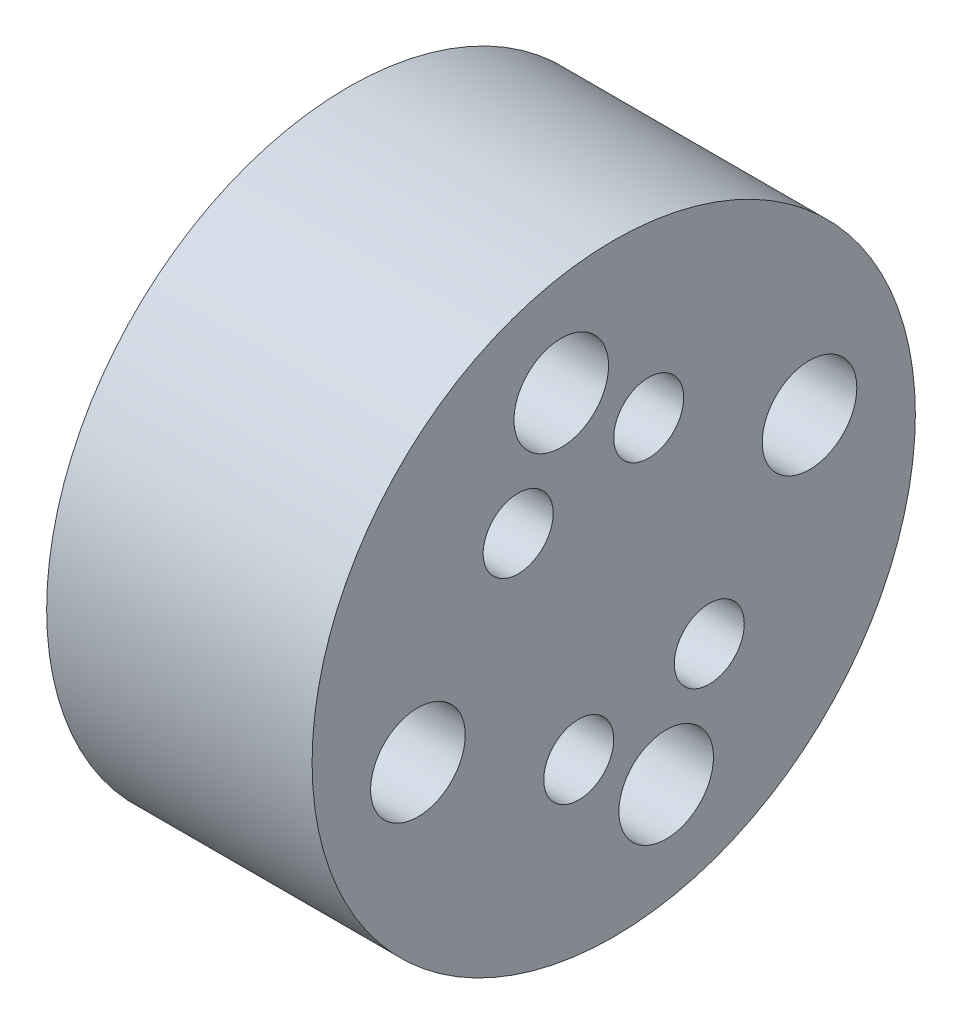
from build123d import *

# Parameters (mm, degrees)
SKETCH1_R           = 31.25
BOSS_EXTRUDE1_DEPTH = 23
SKETCH6_R           = 4
CUT_EXTRUDE3_DEPTH  = 50.820929337
SKETCH7_R           = 4.9
CUT_EXTRUDE4_DEPTH  = 11.5
SKETCH2_R           = 2.125
CUT_EXTRUDE2_DEPTH  = 50.820929337
SKETCH8_R           = 2.85
SKETCH8_R_2         = 2.125
CUT_EXTRUDE5_DEPTH  = 14.5
SKETCH9_R           = 3.625
CUT_EXTRUDE6_DEPTH  = 5
BOSS_EXTRUDE2_START = 4.5
SKETCH10_R          = 31.25
SKETCH10_R_2        = 3.625
SKETCH10_R_3        = 4.9
BOSS_EXTRUDE2_DEPTH = 4.5


with BuildPart() as part:
    # Sketch1 → Boss-Extrude1 (new body)
    with BuildSketch(Plane(origin=(0, 0, 0), x_dir=(0, 0, -1), z_dir=(1, 0, 0))):
        Circle(SKETCH1_R)
    extrude(amount=BOSS_EXTRUDE1_DEPTH)

    # Sketch6 → Cut-Extrude3 (cut, through all)
    with BuildSketch(Plane(origin=(23, 0, 0), x_dir=(0, 0, -1), z_dir=(1, 0, 0))):
        with Locations((-5.435199947, 20.284442352)):
            Circle(SKETCH6_R)
        with Locations((20.284442352, 5.435199947)):
            Circle(SKETCH6_R)
        with Locations((5.435199947, -20.284442352)):
            Circle(SKETCH6_R)
        with Locations((-20.284442352, -5.435199947)):
            Circle(SKETCH6_R)
    extrude(amount=-CUT_EXTRUDE3_DEPTH, mode=Mode.SUBTRACT)

    # Sketch7 → Cut-Extrude4 (cut)
    with BuildSketch(Plane(origin=(23, 0, 0), x_dir=(0, 0, -1), z_dir=(1, 0, 0))):
        with Locations((-5.435199947, 20.284442352)):
            Circle(SKETCH7_R)
        with Locations((20.284442352, 5.435199947)):
            Circle(SKETCH7_R)
        with Locations((5.435199947, -20.284442352)):
            Circle(SKETCH7_R)
        with Locations((-20.284442352, -5.435199947)):
            Circle(SKETCH7_R)
    extrude(amount=-CUT_EXTRUDE4_DEPTH, mode=Mode.SUBTRACT)

    # Sketch2 → Cut-Extrude2 (cut, through all)
    with BuildSketch(Plane(origin=(23, 0, 0), x_dir=(0, 0, -1), z_dir=(1, 0, 0))):
        with Locations((-9.899494937, 9.899494937)):
            Circle(SKETCH2_R)
        with Locations((3.623466631, 13.522961568)):
            Circle(SKETCH2_R)
        with Locations((9.899494937, -9.899494937)):
            Circle(SKETCH2_R)
        with Locations((-3.623466631, -13.522961568)):
            Circle(SKETCH2_R)
    extrude(amount=-CUT_EXTRUDE2_DEPTH, mode=Mode.SUBTRACT)

    # Sketch8 → Cut-Extrude5 (cut)
    # profile 1 of 8: a face of its own
    with BuildSketch(Plane(origin=(23, 0, 0), x_dir=(0, 0, -1), z_dir=(1, 0, 0))):
        with Locations((-9.899494937, 9.899494937)):
            Circle(SKETCH8_R)
        with Locations((-9.899494937, 9.899494937)):
            Circle(SKETCH8_R_2, mode=Mode.SUBTRACT)
    # profile 2 of 8: a face of its own
    with BuildSketch(Plane(origin=(23, 0, 0), x_dir=(0, 0, -1), z_dir=(1, 0, 0))):
        with Locations((-9.899494937, 9.899494937)):
            Circle(SKETCH8_R_2)
    # profile 3 of 8: a face of its own
    with BuildSketch(Plane(origin=(23, 0, 0), x_dir=(0, 0, -1), z_dir=(1, 0, 0))):
        with Locations((3.623466631, 13.522961568)):
            Circle(SKETCH8_R)
        with Locations((3.623466631, 13.522961568)):
            Circle(SKETCH8_R_2, mode=Mode.SUBTRACT)
    # profile 4 of 8: a face of its own
    with BuildSketch(Plane(origin=(23, 0, 0), x_dir=(0, 0, -1), z_dir=(1, 0, 0))):
        with Locations((3.623466631, 13.522961568)):
            Circle(SKETCH8_R_2)
    # profile 5 of 8: a face of its own
    with BuildSketch(Plane(origin=(23, 0, 0), x_dir=(0, 0, -1), z_dir=(1, 0, 0))):
        with Locations((9.899494937, -9.899494937)):
            Circle(SKETCH8_R)
        with Locations((9.899494937, -9.899494937)):
            Circle(SKETCH8_R_2, mode=Mode.SUBTRACT)
    # profile 6 of 8: a face of its own
    with BuildSketch(Plane(origin=(23, 0, 0), x_dir=(0, 0, -1), z_dir=(1, 0, 0))):
        with Locations((9.899494937, -9.899494937)):
            Circle(SKETCH8_R_2)
    # profile 7 of 8: a face of its own
    with BuildSketch(Plane(origin=(23, 0, 0), x_dir=(0, 0, -1), z_dir=(1, 0, 0))):
        with Locations((-3.623466631, -13.522961568)):
            Circle(SKETCH8_R)
        with Locations((-3.623466631, -13.522961568)):
            Circle(SKETCH8_R_2, mode=Mode.SUBTRACT)
    # profile 8 of 8: a face of its own
    with BuildSketch(Plane(origin=(23, 0, 0), x_dir=(0, 0, -1), z_dir=(1, 0, 0))):
        with Locations((-3.623466631, -13.522961568)):
            Circle(SKETCH8_R_2)
    extrude(amount=-CUT_EXTRUDE5_DEPTH, mode=Mode.SUBTRACT)

    # Sketch9 → Cut-Extrude6 (cut)
    with BuildSketch(Plane(origin=(23, 0, 0), x_dir=(0, 0, -1), z_dir=(1, 0, 0))):
        with Locations((-9.899494937, 9.899494937)):
            Circle(SKETCH9_R)
        with Locations((3.623466631, 13.522961568)):
            Circle(SKETCH9_R)
        with Locations((9.899494937, -9.899494937)):
            Circle(SKETCH9_R)
        with Locations((-3.623466631, -13.522961568)):
            Circle(SKETCH9_R)
    extrude(amount=-CUT_EXTRUDE6_DEPTH, mode=Mode.SUBTRACT)

    # Sketch10 → Boss-Extrude2 (add)
    with BuildSketch(Plane(origin=(23, 0, 0), x_dir=(0, 0, -1), z_dir=(1, 0, 0)).offset(BOSS_EXTRUDE2_START)):
        Circle(SKETCH10_R)
        with Locations((-3.623466631, -13.522961568)):
            Circle(SKETCH10_R_2, mode=Mode.SUBTRACT)
        with Locations((-9.899494937, 9.899494937)):
            Circle(SKETCH10_R_2, mode=Mode.SUBTRACT)
        with Locations((-5.435199947, 20.284442352)):
            Circle(SKETCH10_R_3, mode=Mode.SUBTRACT)
        with Locations((20.284442352, 5.435199947)):
            Circle(SKETCH10_R_3, mode=Mode.SUBTRACT)
        with Locations((5.435199947, -20.284442352)):
            Circle(SKETCH10_R_3, mode=Mode.SUBTRACT)
        with Locations((-20.284442352, -5.435199947)):
            Circle(SKETCH10_R_3, mode=Mode.SUBTRACT)
        with Locations((3.623466631, 13.522961568)):
            Circle(SKETCH10_R_2, mode=Mode.SUBTRACT)
        with Locations((9.899494937, -9.899494937)):
            Circle(SKETCH10_R_2, mode=Mode.SUBTRACT)
    extrude(amount=-BOSS_EXTRUDE2_DEPTH)


solid = part.part
